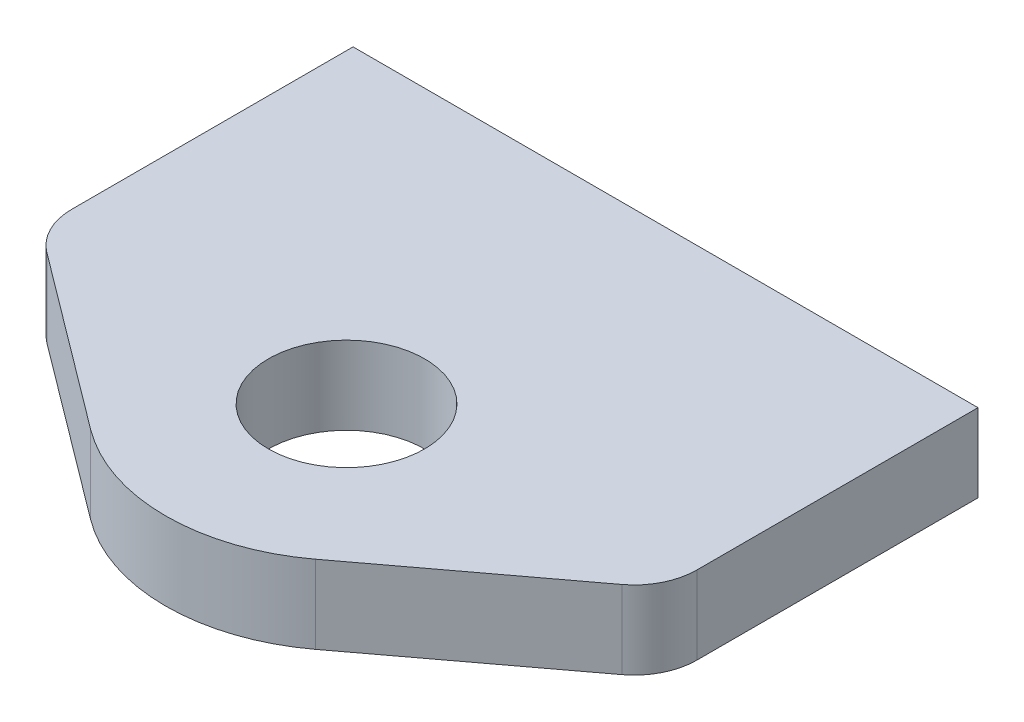
from build123d import *

# Parameters (mm, degrees)
SKETCH1_R           = 3.175
BOSS_EXTRUDE1_DEPTH = 3.175
FILLET1_R           = 7.62
FILLET2_R           = 2.54


with BuildPart() as part:
    # Sketch1 → Boss-Extrude1 (new body)
    with BuildSketch(Plane(origin=(0, 0, 0), x_dir=(1, 0, 0), z_dir=(0, 1, 0))):
        Polygon((-12.7, -6.35), (-12.7, 6.35), (12.7, 6.35), (12.7, -6.35), (0, -15.875), align=None)
        with Locations(Location((-0.266746272, -6.35, 0), (0, 0, 270))):
            Circle(SKETCH1_R, mode=Mode.SUBTRACT)
    extrude(amount=BOSS_EXTRUDE1_DEPTH)

    # Fillet1
    fillet1_edges = [part.edges().sort_by_distance(p)[0] for p in [
        (0, 1.5875, 15.875),
    ]]
    fillet(fillet1_edges, radius=FILLET1_R)

    # Fillet2
    fillet2_edges = [part.edges().sort_by_distance(p)[0] for p in [
        (12.7, 1.5875, 6.35),
        (-12.7, 1.5875, 6.35),
    ]]
    fillet(fillet2_edges, radius=FILLET2_R)


solid = part.part
